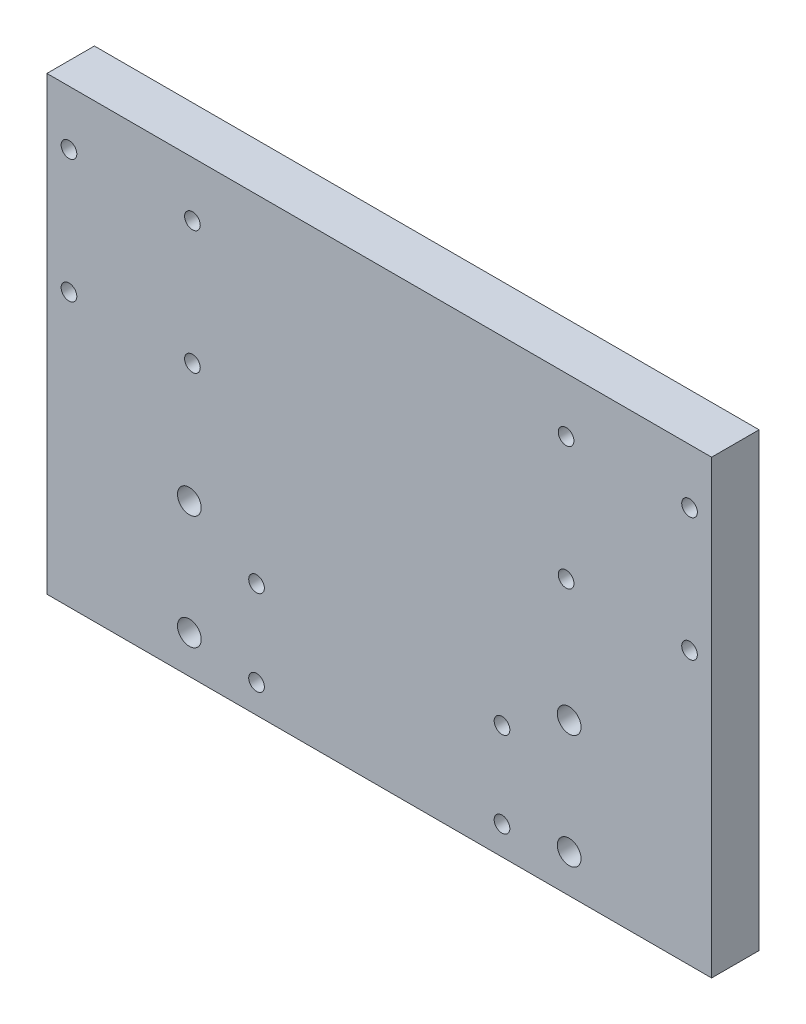
from build123d import *

# Parameters (mm, degrees)
SKETCH_1_W         = 140
SKETCH_1_H         = 95
EXTRUDE_1_DEPTH    = 10
HOLE_WIZARD_M4_1_D = 3.3
HOLE_WIZARD_M6_1_D = 5


with BuildPart() as part:
    # 草图1 → 凸台-拉伸1 (new body)
    with BuildSketch(Plane.XY):
        with Locations((70, 47.5)):
            Rectangle(SKETCH_1_W, SKETCH_1_H)
    extrude(amount=EXTRUDE_1_DEPTH)

    # M4 螺纹孔1 (through all)
    with Locations(Plane(origin=(4.65, 83.45, 10), x_dir=(1, 0, 0), z_dir=(0, 0, 1))):
        with Locations((0, 0), (0, -26), (26, -26), (26, 0), (104.7, 0), (130.7, 0), (130.7, -26), (104.7, -26), (39.5, -59.45), (39.5, -77.45), (91.2, -59.45), (91.2, -77.45)):
            Hole(HOLE_WIZARD_M4_1_D / 2)

    # M6 螺纹孔1 (through all)
    with Locations(Plane(origin=(30, 32, 10), x_dir=(1, 0, 0), z_dir=(0, 0, 1))):
        with Locations((0, 0), (0, -24), (80, 0), (80, -24)):
            Hole(HOLE_WIZARD_M6_1_D / 2)


solid = part.part
